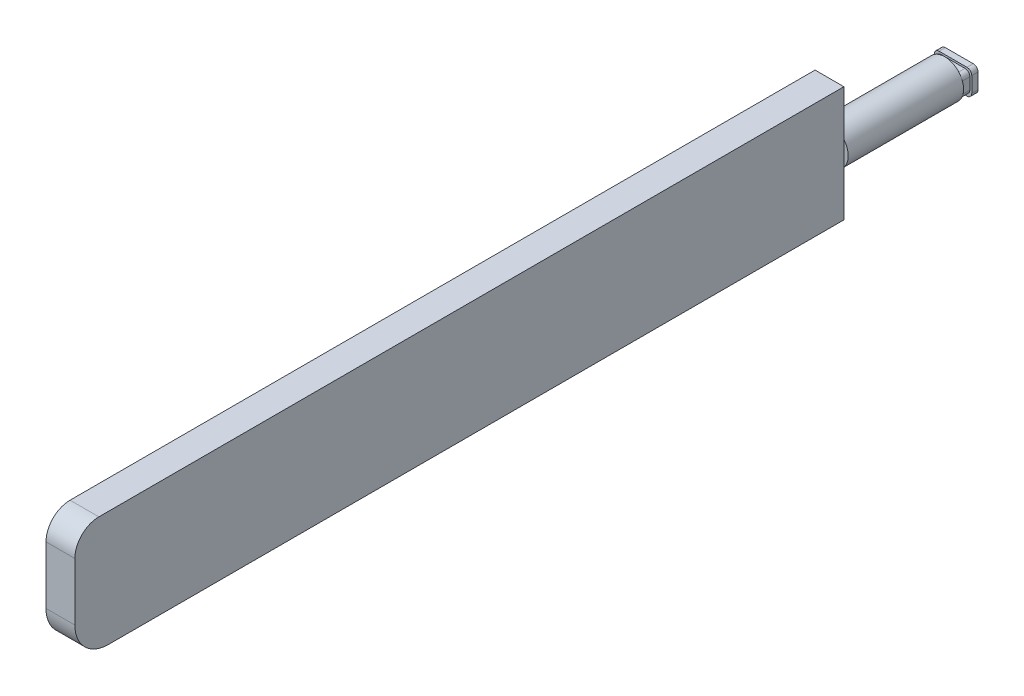
from build123d import *

# Parameters (mm, degrees)
SKETCH1_W           = 39
SKETCH1_H           = 26
BOSS_EXTRUDE1_DEPTH = 15
SKETCH2_W           = 39
SKETCH2_H           = 26
SKETCH2_W_2         = 35
SKETCH2_H_2         = 22
CUT_EXTRUDE1_DEPTH  = 8.5
FILLET1_R           = 5
SKETCH3_R           = 19.5
BOSS_EXTRUDE2_DEPTH = 120
BOSS_EXTRUDE3_DEPTH = 15
FILLET2_R           = 25
FILLET3_R           = 35


with BuildPart() as part:
    # Sketch1 → Boss-Extrude1 (new body)
    with BuildSketch(Plane.XY):
        Rectangle(SKETCH1_W, SKETCH1_H)
    extrude(amount=BOSS_EXTRUDE1_DEPTH)

    # Sketch2 → Cut-Extrude1 (cut)
    with BuildSketch(Plane.XY.offset(15)):
        Rectangle(SKETCH2_W, SKETCH2_H)
        Rectangle(SKETCH2_W_2, SKETCH2_H_2, mode=Mode.SUBTRACT)
    extrude(amount=-CUT_EXTRUDE1_DEPTH, mode=Mode.SUBTRACT)

    # Fillet1
    fillet1_edges = [part.edges().sort_by_distance(p)[0] for p in [
        (19.5, -13, 3.25),
        (-19.5, -13, 3.25),
        (-19.5, 13, 3.25),
        (19.5, 13, 3.25),
        (17.5, -11, 10.75),
        (17.5, 11, 10.75),
        (-17.5, 11, 10.75),
        (-17.5, -11, 10.75),
    ]]
    fillet(fillet1_edges, radius=FILLET1_R)

    # Sketch3 → Boss-Extrude2 (add)
    with BuildSketch(Plane.XY.offset(15)):
        Circle(SKETCH3_R)
    extrude(amount=BOSS_EXTRUDE2_DEPTH)

    # Sketch4 → Boss-Extrude3 (add, symmetric)
    with BuildSketch(Plane(origin=(0, 0, 0), x_dir=(0, 0, -1), z_dir=(1, 0, 0))):
        Polygon((-135, 19.5), (-135, -19.5), (-135, -60), (-935, -60), (-935, 60), (-135, 60), align=None)
    extrude(amount=BOSS_EXTRUDE3_DEPTH, both=True)

    # Fillet2
    fillet2_edges = [part.edges().sort_by_distance(p)[0] for p in [
        (0, 60, 935),
    ]]
    fillet(fillet2_edges, radius=FILLET2_R)

    # Fillet3
    fillet3_edges = [part.edges().sort_by_distance(p)[0] for p in [
        (0, -60, 935),
    ]]
    fillet(fillet3_edges, radius=FILLET3_R)


solid = part.part
